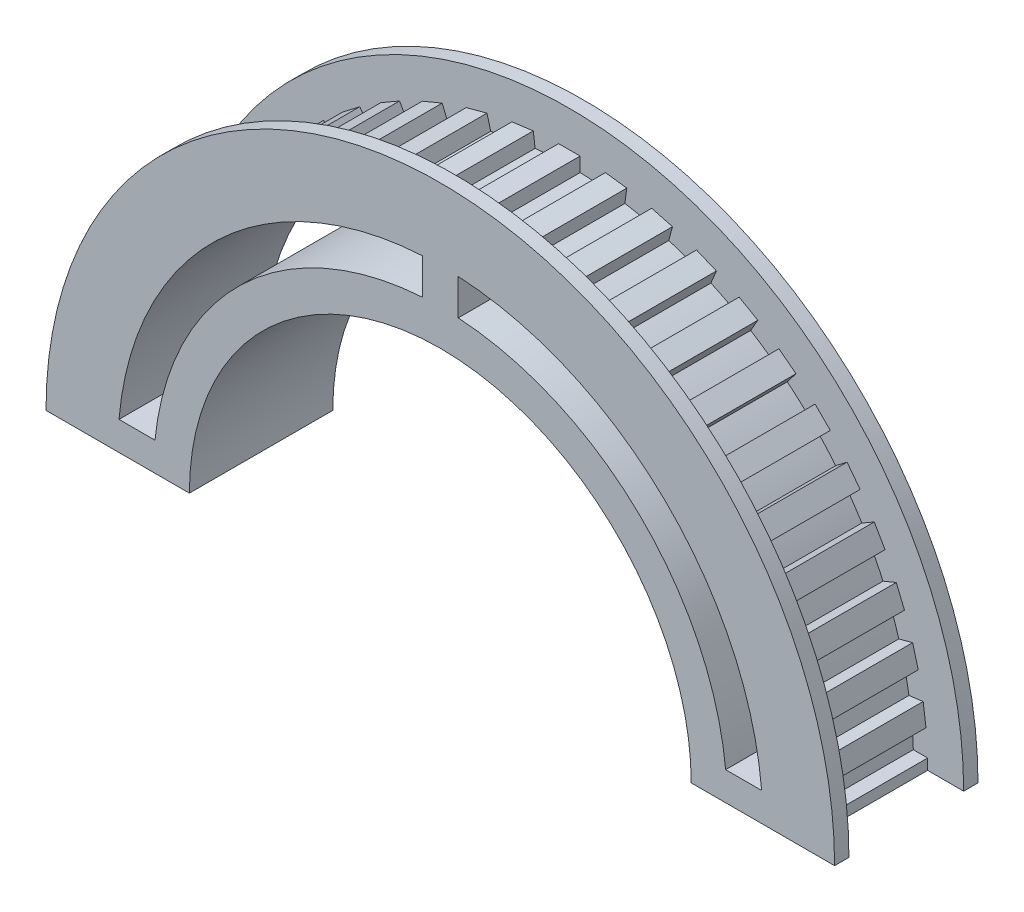
from build123d import *

# Parameters (mm, degrees)
BOSS_EXTRUDE1_DEPTH = 20
CUT_EXTRUDE2_REACH  = 75.453
SKETCH3_R           = 1.5
BOSS_EXTRUDE3_DEPTH = 2
BOSS_EXTRUDE4_START = -2
BOSS_EXTRUDE4_DEPTH = 2


with BuildPart() as part:
    # Sketch1 → Boss-Extrude1 (new body)
    with BuildSketch(Plane.XY):
        with BuildLine():
            Line((35, 0), (49.976556775, 0))
            Line((49.976556775, 0), (49.976556775, 1.5))
            Line((49.976556775, 1.5), (47.976556775, 1.5))
            ThreePointArc((47.976556775, 1.5), (47.897228315, 3.139350203), (47.761899969, 4.77502998))
            Line((47.761899969, 4.77502998), (49.744789692, 5.036082364))
            Line((49.744789692, 5.036082364), (49.353211116, 8.010416948))
            Line((49.353211116, 8.010416948), (47.370321393, 7.749364564))
            ThreePointArc((47.370321393, 7.749364564), (47.077693459, 9.364335457), (46.730023813, 10.968357872))
            Line((46.730023813, 10.968357872), (48.661875466, 11.485995963))
            Line((48.661875466, 11.485995963), (47.88541833, 14.383773441))
            Line((47.88541833, 14.383773441), (45.953566678, 13.866135351))
            ThreePointArc((45.953566678, 13.866135351), (45.452646216, 15.429094335), (44.898583993, 16.974014121))
            Line((44.898583993, 16.974014121), (46.746343059, 17.739380986))
            Line((46.746343059, 17.739380986), (45.598292761, 20.511019583))
            Line((45.598292761, 20.511019583), (43.750533696, 19.745652719))
            ThreePointArc((43.750533696, 19.745652719), (43.049891594, 21.229857131), (42.298916953, 22.689240282))
            Line((42.298916953, 22.689240282), (44.030967761, 23.689240282))
            Line((44.030967761, 23.689240282), (42.530967761, 26.287316493))
            Line((42.530967761, 26.287316493), (40.798916953, 25.287316493))
            ThreePointArc((40.798916953, 25.287316493), (39.910541391, 26.667371185), (38.975503717, 28.016247251))
            Line((38.975503717, 28.016247251), (40.562210397, 29.233770109))
            Line((40.562210397, 29.233770109), (38.73592611, 31.61383013))
            Line((38.73592611, 31.61383013), (37.14921943, 30.396307272))
            ThreePointArc((37.14921943, 30.396307272), (36.088310759, 31.648599125), (34.985208805, 32.863888462))
            Line((34.985208805, 32.863888462), (36.399422368, 34.278102024))
            Line((36.399422368, 34.278102024), (34.278102024, 36.399422368))
            Line((34.278102024, 36.399422368), (32.863888462, 34.985208805))
            ThreePointArc((32.863888462, 34.985208805), (31.648599125, 36.088310759), (30.396307272, 37.14921943))
            Line((30.396307272, 37.14921943), (31.61383013, 38.73592611))
            Line((31.61383013, 38.73592611), (29.233770109, 40.562210397))
            Line((29.233770109, 40.562210397), (28.016247251, 38.975503717))
            ThreePointArc((28.016247251, 38.975503717), (26.667371185, 39.910541391), (25.287316493, 40.798916953))
            Line((25.287316493, 40.798916953), (26.287316493, 42.530967761))
            Line((26.287316493, 42.530967761), (23.689240282, 44.030967761))
            Line((23.689240282, 44.030967761), (22.689240282, 42.298916953))
            ThreePointArc((22.689240282, 42.298916953), (21.229857131, 43.049891594), (19.745652719, 43.750533696))
            Line((19.745652719, 43.750533696), (20.511019583, 45.598292761))
            Line((20.511019583, 45.598292761), (17.739380986, 46.746343059))
            Line((17.739380986, 46.746343059), (16.974014121, 44.898583993))
            ThreePointArc((16.974014121, 44.898583993), (15.429094335, 45.452646216), (13.866135351, 45.953566678))
            Line((13.866135351, 45.953566678), (14.383773441, 47.88541833))
            Line((14.383773441, 47.88541833), (11.485995963, 48.661875466))
            Line((11.485995963, 48.661875466), (10.968357872, 46.730023813))
            ThreePointArc((10.968357872, 46.730023813), (9.364335457, 47.077693459), (7.749364564, 47.370321393))
            Line((7.749364564, 47.370321393), (8.010416948, 49.353211116))
            Line((8.010416948, 49.353211116), (5.036082364, 49.744789692))
            Line((5.036082364, 49.744789692), (4.77502998, 47.761899969))
            ThreePointArc((4.77502998, 47.761899969), (3.139350203, 47.897228315), (1.5, 47.976556775))
            Line((1.5, 47.976556775), (1.5, 49.976556775))
            Line((1.5, 49.976556775), (-1.5, 49.976556775))
            Line((-1.5, 49.976556775), (-1.5, 47.976556775))
            ThreePointArc((-1.5, 47.976556775), (-3.139350203, 47.897228315), (-4.77502998, 47.761899969))
            Line((-4.77502998, 47.761899969), (-5.036082364, 49.744789692))
            Line((-5.036082364, 49.744789692), (-8.010416948, 49.353211116))
            Line((-8.010416948, 49.353211116), (-7.749364564, 47.370321393))
            ThreePointArc((-7.749364564, 47.370321393), (-9.364335457, 47.077693459), (-10.968357872, 46.730023813))
            Line((-10.968357872, 46.730023813), (-11.485995963, 48.661875466))
            Line((-11.485995963, 48.661875466), (-14.383773441, 47.88541833))
            Line((-14.383773441, 47.88541833), (-13.866135351, 45.953566678))
            ThreePointArc((-13.866135351, 45.953566678), (-15.429094335, 45.452646216), (-16.974014121, 44.898583993))
            Line((-16.974014121, 44.898583993), (-17.739380986, 46.746343059))
            Line((-17.739380986, 46.746343059), (-20.511019583, 45.598292761))
            Line((-20.511019583, 45.598292761), (-19.745652719, 43.750533696))
            ThreePointArc((-19.745652719, 43.750533696), (-21.229857131, 43.049891594), (-22.689240282, 42.298916953))
            Line((-22.689240282, 42.298916953), (-23.689240282, 44.030967761))
            Line((-23.689240282, 44.030967761), (-26.287316493, 42.530967761))
            Line((-26.287316493, 42.530967761), (-25.287316493, 40.798916953))
            ThreePointArc((-25.287316493, 40.798916953), (-26.667371185, 39.910541391), (-28.016247251, 38.975503717))
            Line((-28.016247251, 38.975503717), (-29.233770109, 40.562210397))
            Line((-29.233770109, 40.562210397), (-31.61383013, 38.73592611))
            Line((-31.61383013, 38.73592611), (-30.396307272, 37.14921943))
            ThreePointArc((-30.396307272, 37.14921943), (-31.648599125, 36.088310759), (-32.863888462, 34.985208805))
            Line((-32.863888462, 34.985208805), (-34.278102024, 36.399422368))
            Line((-34.278102024, 36.399422368), (-36.399422368, 34.278102024))
            Line((-36.399422368, 34.278102024), (-34.985208805, 32.863888462))
            ThreePointArc((-34.985208805, 32.863888462), (-36.088310759, 31.648599125), (-37.14921943, 30.396307272))
            Line((-37.14921943, 30.396307272), (-38.73592611, 31.61383013))
            Line((-38.73592611, 31.61383013), (-40.562210397, 29.233770109))
            Line((-40.562210397, 29.233770109), (-38.975503717, 28.016247251))
            ThreePointArc((-38.975503717, 28.016247251), (-39.910541391, 26.667371185), (-40.798916953, 25.287316493))
            Line((-40.798916953, 25.287316493), (-42.530967761, 26.287316493))
            Line((-42.530967761, 26.287316493), (-44.030967761, 23.689240282))
            Line((-44.030967761, 23.689240282), (-42.298916953, 22.689240282))
            ThreePointArc((-42.298916953, 22.689240282), (-43.049891594, 21.229857131), (-43.750533696, 19.745652719))
            Line((-43.750533696, 19.745652719), (-45.598292761, 20.511019583))
            Line((-45.598292761, 20.511019583), (-46.746343059, 17.739380986))
            Line((-46.746343059, 17.739380986), (-44.898583993, 16.974014121))
            ThreePointArc((-44.898583993, 16.974014121), (-45.452646216, 15.429094335), (-45.953566678, 13.866135351))
            Line((-45.953566678, 13.866135351), (-47.88541833, 14.383773441))
            Line((-47.88541833, 14.383773441), (-48.661875466, 11.485995963))
            Line((-48.661875466, 11.485995963), (-46.730023813, 10.968357872))
            ThreePointArc((-46.730023813, 10.968357872), (-47.077693459, 9.364335457), (-47.370321393, 7.749364564))
            Line((-47.370321393, 7.749364564), (-49.353211116, 8.010416948))
            Line((-49.353211116, 8.010416948), (-49.744789692, 5.036082364))
            Line((-49.744789692, 5.036082364), (-47.761899969, 4.77502998))
            ThreePointArc((-47.761899969, 4.77502998), (-47.897228315, 3.139350203), (-47.976556775, 1.5))
            Line((-47.976556775, 1.5), (-49.976556775, 1.5))
            Line((-49.976556775, 1.5), (-49.976556775, 0))
            Line((-49.976556775, 0), (-35, 0))
            ThreePointArc((-35, 0), (0, 35), (35, 0))
        make_face()
        with BuildLine():
            Line((44.821869662, 4), (39.799497484, 4))
            ThreePointArc((39.799497484, 4), (27.747175978, 28.811355839), (2.5, 39.921798557))
            Line((2.5, 39.921798557), (2.5, 44.930501889))
            ThreePointArc((2.5, 44.930501889), (31.283643223, 32.34708127), (44.821869662, 4))
        make_face(mode=Mode.SUBTRACT)
        with BuildLine():
            ThreePointArc((-44.821869662, 4), (-31.283643223, 32.34708127), (-2.5, 44.930501889))
            Line((-2.5, 44.930501889), (-2.5, 39.921798557))
            ThreePointArc((-2.5, 39.921798557), (-27.747175978, 28.811355839), (-39.799497484, 4))
            Line((-39.799497484, 4), (-44.821869662, 4))
        make_face(mode=Mode.SUBTRACT)
    extrude(amount=BOSS_EXTRUDE1_DEPTH)

    # Sketch3 → Cut-Extrude2 (cut, up to next)
    with BuildSketch(Plane.XZ, mode=Mode.PRIVATE) as cut_extrude2_sk1:
        with Locations(Location((-42.5, 10, 0), (0, 0, 270))):
            Circle(SKETCH3_R)
    cut_extrude2_tool1 = extrude(cut_extrude2_sk1.sketch, amount=-CUT_EXTRUDE2_REACH, mode=Mode.PRIVATE) & part.part
    cut_extrude2 = cut_extrude2_tool1.solids().sort_by_distance((-42.5, 0, 10))[0]
    add(cut_extrude2, mode=Mode.SUBTRACT)

    # Mirror2: Cut-Extrude2 across plane
    add(cut_extrude2.mirror(Plane(origin=(0, 0, 0), x_dir=(0, 0, 1), z_dir=(1, 0, 0))), mode=Mode.SUBTRACT)

    # Sketch5 → Boss-Extrude3 (add)
    with BuildSketch(Plane.XY):
        with BuildLine():
            Line((-48, 0), (-55, 0))
            ThreePointArc((-55, 0), (0, 55), (55, 0))
            Line((55, 0), (48, 0))
            ThreePointArc((48, 0), (0, 48), (-48, 0))
        make_face()
    extrude(amount=BOSS_EXTRUDE3_DEPTH)

    # Sketch6 → Boss-Extrude4 (add)
    with BuildSketch(Plane.XY.offset(20).offset(BOSS_EXTRUDE4_START)):
        with BuildLine():
            Line((-45, 0), (-55, 0))
            ThreePointArc((-55, 0), (0, 55), (55, 0))
            Line((55, 0), (45, 0))
            ThreePointArc((45, 0), (0, 45), (-45, 0))
        make_face()
    extrude(amount=BOSS_EXTRUDE4_DEPTH)


solid = part.part
